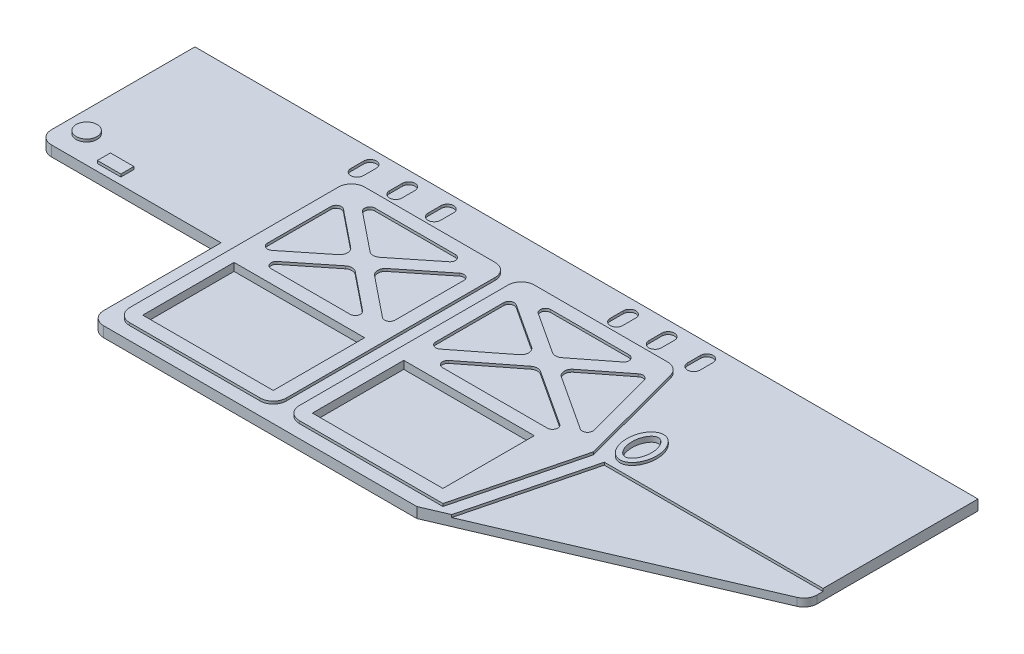
from build123d import *

# Parameters (mm, degrees)
SKETCH1_W                = 381
SKETCH1_H                = 6.35
BOSS_EXTRUDE1_DEPTH      = 139.7
CUT_EXTRUDE1_DEPTH       = 406.853930004
SKETCH3_W                = 63.5
SKETCH3_H                = 44.45
CUT_EXTRUDE2_DEPTH       = 406.853930004
CUT_EXTRUDE3_DEPTH       = 1.27
CUT_EXTRUDE4_DEPTH       = 1.27
CUT_EXTRUDE5_DEPTH       = 1.27
SKETCH7_RX               = 10.638157658
SKETCH7_RY               = 7.265083279
BOSS_EXTRUDE2_DEPTH      = 1.27
CUT_EXTRUDE6_DEPTH       = 2.54
SKETCH9_R                = 7.62
BOSS_EXTRUDE3_DEPTH      = 1.27
SKETCH10_R               = 5.08
CUT_EXTRUDE7_DEPTH       = 2.54
CUT_EXTRUDE10_DEPTH      = 1.27
SKETCH14_R               = 5.08
SKETCH14_W               = 11.43
SKETCH14_H               = 6.35
BOSS_EXTRUDE4_DEPTH      = 1.27
BOSS_EXTRUDE5_DEPTH      = 1.27
BOSS_EXTRUDE5_DEPTH_BACK = 1.27


with BuildPart() as part:
    # Sketch1 → Boss-Extrude1 (new body)
    with BuildSketch(Plane.XY):
        with Locations((-190.5, 3.175)):
            Rectangle(SKETCH1_W, SKETCH1_H)
    extrude(amount=BOSS_EXTRUDE1_DEPTH)

    # Sketch2 → Cut-Extrude1 (cut, through all)
    with BuildSketch(Plane.XZ):
        with BuildLine():
            ThreePointArc((-381, 69.85), (-379.140128061, 74.340128061), (-374.65, 76.2))
            Line((-374.65, 76.2), (-292.1, 76.2))
            Line((-292.1, 76.2), (-292.1, 133.35))
            ThreePointArc((-292.1, 133.35), (-290.240128061, 137.840128061), (-285.75, 139.7))
            Line((-285.75, 139.7), (-381, 139.7))
            Line((-381, 139.7), (-381, 69.85))
        make_face()
        with BuildLine():
            Line((0, 139.7), (-133.35, 139.7))
            Line((-133.35, 139.7), (-3.848612454, 84.199405337))
            ThreePointArc((-3.848612454, 84.199405337), (-1.048759064, 81.858452302), (0, 78.362834397))
            Line((0, 78.362834397), (0, 139.7))
        make_face()
    extrude(amount=-CUT_EXTRUDE1_DEPTH, mode=Mode.SUBTRACT)

    # Sketch3 → Cut-Extrude2 (cut, through all)
    with BuildSketch(Plane(origin=(0, 6.35, 0), x_dir=(1, 0, 0), z_dir=(0, 1, 0))):
        with Locations((-165.1, -104.775)):
            Rectangle(SKETCH3_W, SKETCH3_H)
        with Locations((-247.65, -104.775)):
            Rectangle(SKETCH3_W, SKETCH3_H)
    extrude(amount=-CUT_EXTRUDE2_DEPTH, mode=Mode.SUBTRACT)

    # Sketch4 → Cut-Extrude3 (cut)
    with BuildSketch(Plane.XZ):
        with BuildLine():
            Line((-3.848612454, 84.199405337), (-133.35, 139.7))
            Line((-133.35, 139.7), (-285.75, 139.7))
            ThreePointArc((-285.75, 139.7), (-290.240128061, 137.840128061), (-292.1, 133.35))
            Line((-292.1, 133.35), (-292.1, 76.2))
            Line((-292.1, 76.2), (-374.65, 76.2))
            ThreePointArc((-374.65, 76.2), (-379.140128061, 74.340128061), (-381, 69.85))
            Line((-381, 69.85), (-381, 0))
            Line((-381, 0), (0, 0))
            Line((0, 0), (0, 78.362834397))
            ThreePointArc((0, 78.362834397), (-1.048759064, 81.858452302), (-3.848612454, 84.199405337))
        make_face()
        with BuildLine():
            ThreePointArc((-285.75, 127), (-283.890128061, 131.490128061), (-279.4, 133.35))
            Line((-279.4, 133.35), (-215.9, 133.35))
            ThreePointArc((-215.9, 133.35), (-211.409871939, 131.490128061), (-209.55, 127))
            Line((-209.55, 127), (-209.55, 25.4))
            ThreePointArc((-209.55, 25.4), (-211.409871939, 20.909871939), (-215.9, 19.05))
            Line((-215.9, 19.05), (-279.4, 19.05))
            ThreePointArc((-279.4, 19.05), (-283.890128061, 20.909871939), (-285.75, 25.4))
            Line((-285.75, 25.4), (-285.75, 127))
        make_face(mode=Mode.SUBTRACT)
        with BuildLine():
            Line((-196.85, 133.35), (-127, 133.35))
            Line((-127, 133.35), (-112.137573981, 74.878893992))
            Line((-112.137573981, 74.878893992), (-125.744419224, 23.76643633))
            ThreePointArc((-125.744419224, 23.76643633), (-128.010988421, 20.365338676), (-131.88070228, 19.05))
            Line((-131.88070228, 19.05), (-196.85, 19.05))
            ThreePointArc((-196.85, 19.05), (-201.340128061, 20.909871939), (-203.2, 25.4))
            Line((-203.2, 25.4), (-203.2, 127))
            ThreePointArc((-203.2, 127), (-201.340128061, 131.490128061), (-196.85, 133.35))
        make_face(mode=Mode.SUBTRACT)
    cut_extrude3 = extrude(amount=-CUT_EXTRUDE3_DEPTH, mode=Mode.SUBTRACT)

    # Sketch5 → Cut-Extrude4 (cut)
    with BuildSketch(Plane.XZ):
        with BuildLine():
            ThreePointArc((-158.992065813, 53.903274114), (-161.23709196, 53.287195771), (-163.421462968, 54.092315777))
            Line((-163.421462968, 54.092315777), (-185.887975323, 71.659056802))
            ThreePointArc((-185.887975323, 71.659056802), (-186.724879694, 74.487406876), (-184.323422249, 76.2))
            Line((-184.323422249, 76.2), (-133.639840253, 76.2))
            Line((-133.639840253, 76.2), (-133.371973018, 76.2))
            ThreePointArc((-133.371973018, 76.2), (-130.937419027, 74.384256076), (-131.983594655, 71.533029027))
            Line((-131.983594655, 71.533029027), (-158.992065813, 53.903274114))
        make_face()
        with BuildLine():
            ThreePointArc((-134.022318328, 31.104895564), (-131.650325923, 30.697594229), (-130.003252032, 32.452413293))
            Line((-130.003252032, 32.452413293), (-121.14221986, 65.737801909))
            ThreePointArc((-121.14221986, 65.737801909), (-122.107836854, 68.449087436), (-124.985111445, 68.51819835))
            Line((-124.985111445, 68.51819835), (-151.528786111, 51.191838923))
            ThreePointArc((-151.528786111, 51.191838923), (-153.252753369, 48.163841066), (-151.793048177, 44.999967667))
            Line((-151.793048177, 44.999967667), (-134.022318328, 31.104895564))
        make_face()
        with BuildLine():
            ThreePointArc((-144.407280031, 25.4), (-142.005822585, 27.112593124), (-142.842726957, 29.940943198))
            Line((-142.842726957, 29.940943198), (-159.460209971, 42.934282617))
            ThreePointArc((-159.460209971, 42.934282617), (-161.644580979, 43.739402623), (-163.889607126, 43.123324281))
            Line((-163.889607126, 43.123324281), (-183.891708315, 30.066970973))
            ThreePointArc((-183.891708315, 30.066970973), (-184.937883944, 27.215743924), (-182.503329952, 25.4))
            Line((-182.503329952, 25.4), (-144.407280031, 25.4))
        make_face()
        with BuildLine():
            Line((-196.85, 66.959325487), (-196.85, 33.882758471))
            ThreePointArc((-196.85, 33.882758471), (-195.519363254, 31.649142452), (-192.921621637, 31.755787497))
            Line((-192.921621637, 31.755787497), (-171.352886828, 45.834759471))
            ThreePointArc((-171.352886828, 45.834759471), (-169.62891957, 48.862757328), (-171.088624762, 52.026630727))
            Line((-171.088624762, 52.026630727), (-192.745446926, 68.960268685))
            ThreePointArc((-192.745446926, 68.960268685), (-195.423021831, 69.242477345), (-196.85, 66.959325487))
        make_face()
        with BuildLine():
            Line((-215.9, 34.229440484), (-215.9, 67.737366324))
            ThreePointArc((-215.9, 67.737366324), (-217.342192636, 70.027872598), (-220.031038577, 69.71731487))
            Line((-220.031038577, 69.71731487), (-239.692082997, 53.918176966))
            ThreePointArc((-239.692082997, 53.918176966), (-241.115522876, 50.944107883), (-239.685613264, 47.973143982))
            Line((-239.685613264, 47.973143982), (-220.026725421, 32.246033708))
            ThreePointArc((-220.026725421, 32.246033708), (-217.339700625, 31.940130264), (-215.9, 34.229440484))
        make_face()
        with BuildLine():
            ThreePointArc((-227.288401483, 29.923406776), (-226.478310973, 27.099242369), (-228.875126903, 25.4))
            Line((-228.875126903, 25.4), (-267.965347007, 25.4))
            ThreePointArc((-267.965347007, 25.4), (-270.361246557, 27.096634512), (-269.556385584, 29.919948547))
            Line((-269.556385584, 29.919948547), (-250.848605829, 44.953066112))
            ThreePointArc((-250.848605829, 44.953066112), (-248.466194227, 45.793141036), (-246.081959833, 44.958253456))
            Line((-246.081959833, 44.958253456), (-227.288401483, 29.923406776))
        make_face()
        with BuildLine():
            Line((-246.09497637, 56.919138608), (-227.725938458, 71.680051453))
            ThreePointArc((-227.725938458, 71.680051453), (-226.921077485, 74.503365488), (-229.316977035, 76.2))
            Line((-229.316977035, 76.2), (-267.728199395, 76.2))
            ThreePointArc((-267.728199395, 76.2), (-270.125015326, 74.500757631), (-269.314924816, 71.676593224))
            Line((-269.314924816, 71.676593224), (-250.861622366, 56.913951264))
            ThreePointArc((-250.861622366, 56.913951264), (-248.477387972, 56.079063684), (-246.09497637, 56.919138608))
        make_face()
        with BuildLine():
            Line((-279.4, 66.327898477), (-279.4, 35.455581143))
            ThreePointArc((-279.4, 35.455581143), (-277.957807364, 33.165074869), (-275.268961423, 33.475632597))
            Line((-275.268961423, 33.475632597), (-257.251499201, 47.954027754))
            ThreePointArc((-257.251499201, 47.954027754), (-255.828059322, 50.928096837), (-257.257968935, 53.899060738))
            Line((-257.257968935, 53.899060738), (-275.273274579, 68.311305253))
            ThreePointArc((-275.273274579, 68.311305253), (-277.960299375, 68.617208697), (-279.4, 66.327898477))
        make_face()
    cut_extrude4 = extrude(amount=-CUT_EXTRUDE4_DEPTH, mode=Mode.SUBTRACT)

    # Sketch6 → Cut-Extrude5 (cut)
    with BuildSketch(Plane.XZ.offset(-1.27)):
        with BuildLine():
            Line((-248.158, 6.985), (-248.158, 13.335))
            ThreePointArc((-248.158, 13.335), (-251.206, 16.383), (-254.254, 13.335))
            Line((-254.254, 13.335), (-254.254, 6.985))
            ThreePointArc((-254.254, 6.985), (-251.206, 3.937), (-248.158, 6.985))
        make_face()
        with BuildLine():
            Line((-159.512, 6.985), (-159.512, 13.335))
            ThreePointArc((-159.512, 13.335), (-162.56, 16.383), (-165.608, 13.335))
            Line((-165.608, 13.335), (-165.608, 6.985))
            ThreePointArc((-165.608, 6.985), (-162.56, 3.937), (-159.512, 6.985))
        make_face()
        with BuildLine():
            Line((-140.716, 6.985), (-140.716, 13.335))
            ThreePointArc((-140.716, 13.335), (-143.764, 16.383), (-146.812, 13.335))
            Line((-146.812, 13.335), (-146.812, 6.985))
            ThreePointArc((-146.812, 6.985), (-143.764, 3.937), (-140.716, 6.985))
        make_face()
        with BuildLine():
            Line((-121.92, 6.985), (-121.92, 13.335))
            ThreePointArc((-121.92, 13.335), (-124.968, 16.383), (-128.016, 13.335))
            Line((-128.016, 13.335), (-128.016, 6.985))
            ThreePointArc((-128.016, 6.985), (-124.968, 3.937), (-121.92, 6.985))
        make_face()
        with BuildLine():
            Line((-266.954, 6.985), (-266.954, 13.335))
            ThreePointArc((-266.954, 13.335), (-270.002, 16.383), (-273.05, 13.335))
            Line((-273.05, 13.335), (-273.05, 6.985))
            ThreePointArc((-273.05, 6.985), (-270.002, 3.937), (-266.954, 6.985))
        make_face()
        with BuildLine():
            Line((-285.75, 6.985), (-285.75, 13.335))
            ThreePointArc((-285.75, 13.335), (-288.798, 16.383), (-291.846, 13.335))
            Line((-291.846, 13.335), (-291.846, 6.985))
            ThreePointArc((-291.846, 6.985), (-288.798, 3.937), (-285.75, 6.985))
        make_face()
    cut_extrude5 = extrude(amount=-CUT_EXTRUDE5_DEPTH, mode=Mode.SUBTRACT)

    # Sketch7 → Boss-Extrude2 (add)
    with BuildSketch(Plane.XZ.offset(-1.27)):
        with Locations(Location((-102.329210388, 61.253935302), (0, 0, 90))):
            Ellipse(SKETCH7_RX, SKETCH7_RY)
    boss_extrude2 = extrude(amount=BOSS_EXTRUDE2_DEPTH)

    # Sketch8 → Cut-Extrude6 (cut)
    with BuildSketch(Plane.XZ):
        with BuildLine():
            add(Edge.make_bspline(
                [(-102.329210388, 53.155777643), (-102.112758869, 53.155777643), (-101.90165855, 53.184733869), (-101.488693819, 53.29262333), (-101.285989099, 53.372491654), (-100.906134378, 53.565827315), (-100.726271614, 53.679807762), (-100.382645705, 53.935462419), (-100.219893263, 54.076719563), (-99.764069992, 54.523015248), (-99.497769004, 54.853884591), (-99.020239481, 55.564478945), (-98.814571853, 55.936822891), (-98.456537688, 56.702496854), (-98.303821873, 57.096880827), (-98.043897216, 57.905627606), (-97.93694989, 58.320684281), (-97.685170772, 59.564921728), (-97.604474239, 60.402865358), (-97.603955181, 61.671468822), (-97.624537227, 62.098727862), (-97.707574037, 62.943449926), (-97.769697493, 63.360708886), (-98.019835892, 64.596695994), (-98.268534926, 65.400397992), (-98.81064993, 66.564087993), (-99.016899152, 66.93745653), (-99.490891269, 67.644695452), (-99.76140618, 67.981745124), (-100.216477408, 68.428053725), (-100.376714264, 68.567454964), (-100.718552192, 68.82283879), (-100.901455485, 68.939296763), (-101.281621707, 69.133512578), (-101.480360605, 69.212535587), (-101.897705612, 69.322623081), (-102.108175779, 69.351318098), (-102.532927978, 69.352836862), (-102.749721759, 69.324409496), (-103.163652722, 69.217383132), (-103.364910451, 69.138724573), (-103.747979792, 68.944703036), (-103.92786111, 68.8308471), (-104.269743776, 68.577289353), (-104.432452105, 68.436717912), (-104.892344941, 67.987565013), (-105.158068026, 67.657051526), (-105.632472982, 66.952651746), (-105.84141111, 66.575855339), (-106.381043429, 65.423036607), (-106.633833171, 64.616915287), (-106.88839125, 63.363953584), (-106.950841871, 62.942910835), (-107.033547657, 62.102731031), (-107.054050785, 61.682251454), (-107.054532282, 60.840534907), (-107.034513011, 60.419297982), (-106.952348017, 59.576036803), (-106.889682762, 59.152120735), (-106.637395321, 57.904861607), (-106.38643813, 57.098809521), (-105.845816734, 55.940225585), (-105.638318792, 55.565088352), (-105.283208535, 55.036057222), (-105.157215657, 54.864800233), (-104.887261102, 54.534276909), (-104.742776803, 54.374616224), (-104.438331426, 54.076520809), (-104.277847031, 53.937256286), (-103.936531746, 53.682820747), (-103.753864897, 53.566720171), (-103.373085917, 53.372735724), (-103.175006788, 53.294335437), (-102.759198786, 53.185043833), (-102.545661908, 53.155777643), (-102.329210388, 53.155777643)],
                knots=[0, 0, 0, 0, 0.015625, 0.015625, 0.03125, 0.03125, 0.046875, 0.046875, 0.0625, 0.0625, 0.09375, 0.09375, 0.125, 0.125, 0.15625, 0.15625, 0.1875, 0.1875, 0.25, 0.25, 0.28125, 0.28125, 0.3125, 0.3125, 0.375, 0.375, 0.40625, 0.40625, 0.4375, 0.4375, 0.453125, 0.453125, 0.46875, 0.46875, 0.484375, 0.484375, 0.5, 0.5, 0.515625, 0.515625, 0.53125, 0.53125, 0.546875, 0.546875, 0.5625, 0.5625, 0.59375, 0.59375, 0.625, 0.625, 0.6875, 0.6875, 0.71875, 0.71875, 0.75, 0.75, 0.78125, 0.78125, 0.8125, 0.8125, 0.875, 0.875, 0.90625, 0.90625, 0.921875, 0.921875, 0.9375, 0.9375, 0.953125, 0.953125, 0.96875, 0.96875, 0.984375, 0.984375, 1, 1, 1, 1], degree=3))
        make_face()
    cut_extrude6 = extrude(amount=-CUT_EXTRUDE6_DEPTH, mode=Mode.SUBTRACT)

    # Sketch9 → Boss-Extrude3 (add)
    with BuildSketch(Plane.XZ.offset(-1.27)):
        with Locations(Location((-20.387686115, 60.831492086, 0), (0, 0, 270))):
            Circle(SKETCH9_R)
    extrude(amount=BOSS_EXTRUDE3_DEPTH)

    # Sketch10 → Cut-Extrude7 (cut)
    with BuildSketch(Plane.XZ):
        with Locations(Location((-20.387686115, 60.831492086, 0), (0, 0, 270))):
            Circle(SKETCH10_R)
    extrude(amount=-CUT_EXTRUDE7_DEPTH, mode=Mode.SUBTRACT)

    # Sketch13 → Cut-Extrude10 (cut)
    with BuildSketch(Plane.XZ.offset(-1.27)):
        with BuildLine():
            Line((0, 75.388570939), (0, 78.362834397))
            ThreePointArc((0, 78.362834397), (-1.048759064, 81.858452302), (-3.848612454, 84.199405337))
            Line((-3.848612454, 84.199405337), (-121.475018203, 134.610722087))
            Line((-121.475018203, 134.610722087), (-119.147762172, 125.454933261))
            Line((-119.147762172, 125.454933261), (-106.421688444, 75.388570939))
            Line((-106.421688444, 75.388570939), (0, 75.388570939))
        make_face()
    cut_extrude10 = extrude(amount=-CUT_EXTRUDE10_DEPTH, mode=Mode.SUBTRACT)

    # Sketch14 → Boss-Extrude4 (add)
    with BuildSketch(Plane.XZ.offset(-1.27)):
        with Locations(Location((-370.84, 62.855298511, 0), (0, 0, 270))):
            Circle(SKETCH14_R)
        with Locations((-349.885, 69.692429512)):
            Rectangle(SKETCH14_W, SKETCH14_H)
    boss_extrude4 = extrude(amount=BOSS_EXTRUDE4_DEPTH)

    # Mirror7: Cut-Extrude3 across plane
    add(cut_extrude3.mirror(Plane(origin=(0, 3.175, 0), x_dir=(0, 0, 1), z_dir=(0, -1, 0))), mode=Mode.SUBTRACT)

    # Mirror8: Cut-Extrude4, Cut-Extrude5, Boss-Extrude2, Cut-Extrude6 across plane
    add(cut_extrude4.mirror(Plane(origin=(0, 3.175, 0), x_dir=(0, 0, 1), z_dir=(0, -1, 0))), mode=Mode.SUBTRACT)
    add(cut_extrude5.mirror(Plane(origin=(0, 3.175, 0), x_dir=(0, 0, 1), z_dir=(0, -1, 0))), mode=Mode.SUBTRACT)
    add(boss_extrude2.mirror(Plane(origin=(0, 3.175, 0), x_dir=(0, 0, 1), z_dir=(0, -1, 0))))
    add(cut_extrude6.mirror(Plane(origin=(0, 3.175, 0), x_dir=(0, 0, 1), z_dir=(0, -1, 0))), mode=Mode.SUBTRACT)

    # Mirror9: Cut-Extrude10, Boss-Extrude4 across plane
    add(cut_extrude10.mirror(Plane(origin=(0, 3.175, 0), x_dir=(0, 0, 1), z_dir=(0, -1, 0))), mode=Mode.SUBTRACT)
    add(boss_extrude4.mirror(Plane(origin=(0, 3.175, 0), x_dir=(0, 0, 1), z_dir=(0, -1, 0))))

    # Sketch15 → Boss-Extrude5 (add, two sides: drawn at the far end of the back side and taken through both)
    with BuildSketch(Plane.XZ.offset(-1.27).offset(-BOSS_EXTRUDE5_DEPTH_BACK)):
        with BuildLine():
            Line((-381, 69.85), (-381, 0))
            Line((-381, 0), (0, 0))
            Line((0, 0), (0, 75.388570939))
            Line((0, 75.388570939), (0, 78.362834397))
            ThreePointArc((0, 78.362834397), (-1.048759064, 81.858452302), (-3.848612454, 84.199405337))
            Line((-3.848612454, 84.199405337), (-121.475018203, 134.610722087))
            Line((-121.475018203, 134.610722087), (-133.35, 139.7))
            Line((-133.35, 139.7), (-285.75, 139.7))
            ThreePointArc((-285.75, 139.7), (-290.240128061, 137.840128061), (-292.1, 133.35))
            Line((-292.1, 133.35), (-292.1, 76.2))
            Line((-292.1, 76.2), (-374.65, 76.2))
            ThreePointArc((-374.65, 76.2), (-379.140128061, 74.340128061), (-381, 69.85))
        make_face()
    extrude(amount=BOSS_EXTRUDE5_DEPTH + BOSS_EXTRUDE5_DEPTH_BACK)


solid = part.part
